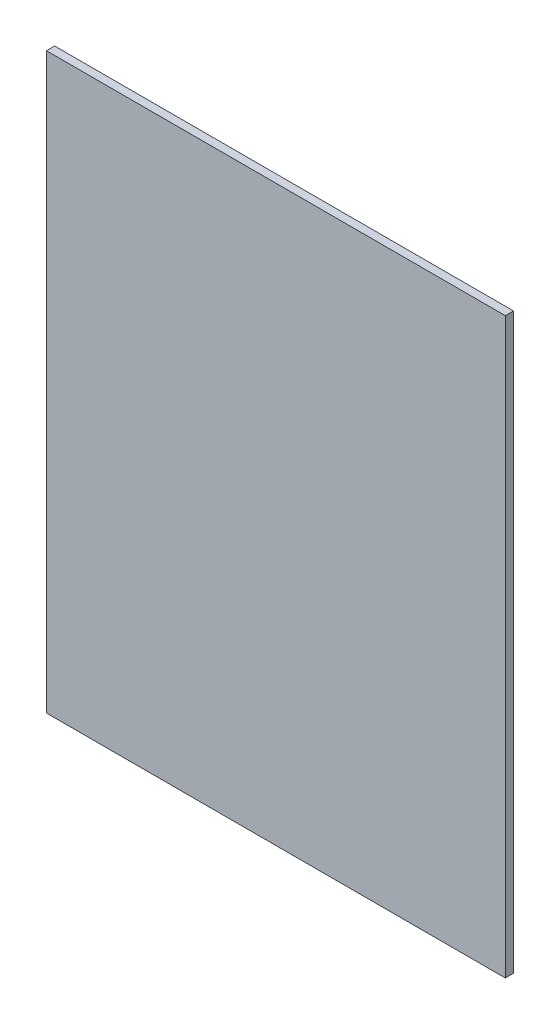
from build123d import *

# Parameters (mm, degrees)
SKETCH_1_W      = 560
SKETCH_1_H      = 700
EXTRUDE_1_DEPTH = 10


with BuildPart() as part:
    # 草图1 → 凸台-拉伸1 (new body)
    with BuildSketch(Plane.XY):
        with Locations((280, -350)):
            Rectangle(SKETCH_1_W, SKETCH_1_H)
    extrude(amount=EXTRUDE_1_DEPTH)


solid = part.part
